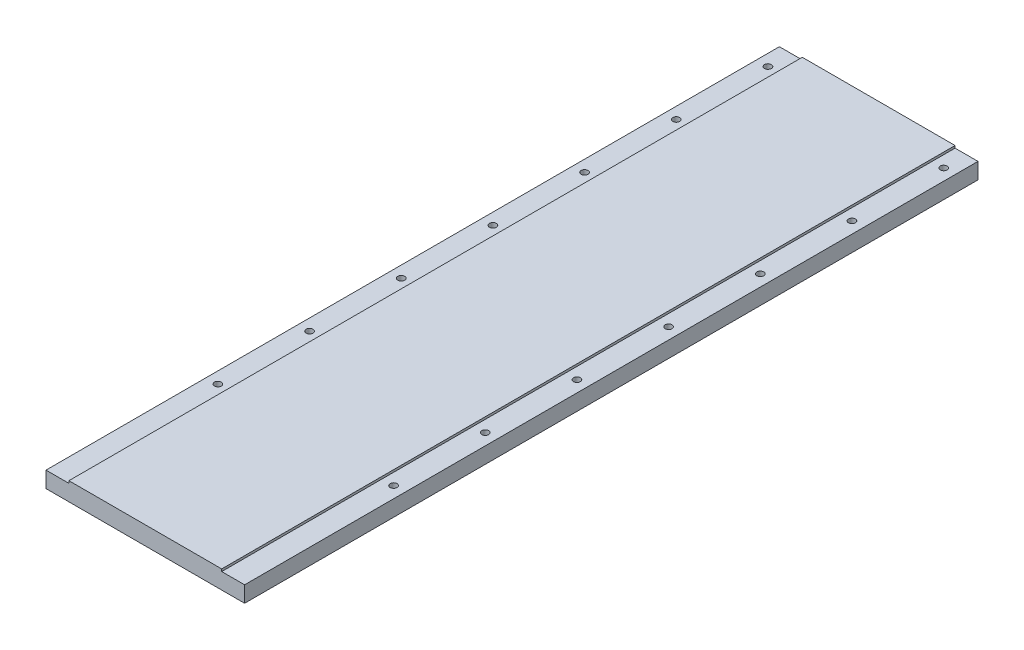
from build123d import *

# Parameters (mm, degrees)
BOSS_EXTRUDE1_DEPTH  = 480
M4_CLEARANCE_HOLE1_D = 4.5
M4_CLEARANCE_HOLE2_D = 4.5


with BuildPart() as part:
    # Sketch1 → Boss-Extrude1 (new body)
    with BuildSketch(Plane.XY):
        Polygon((-65, 0), (65, 0), (65, 10.5), (50, 10.5), (50, 12), (-50, 12), (-50, 10.5), (-65, 10.5), align=None)
    extrude(amount=BOSS_EXTRUDE1_DEPTH)

    # M4 Clearance Hole1 (through all)
    with Locations(Plane(origin=(14.850423209, 10.5, 240), x_dir=(1, 0, 0), z_dir=(0, 1, 0))):
        with Locations((-72.350423209, -135), (-72.350423209, 225), (-72.350423209, -75), (-72.350423209, -15), (-72.350423209, 45), (-72.350423209, 105), (-72.350423209, 165)):
            Hole(M4_CLEARANCE_HOLE1_D / 2)

    # M4 Clearance Hole2 (through all)
    with Locations(Plane(origin=(14.850423209, 10.5, 240), x_dir=(1, 0, 0), z_dir=(0, 1, 0))):
        with Locations((42.649576791, -135), (42.649576791, 225), (42.649576791, -75), (42.649576791, -15), (42.649576791, 45), (42.649576791, 105), (42.649576791, 165)):
            Hole(M4_CLEARANCE_HOLE2_D / 2)


solid = part.part
